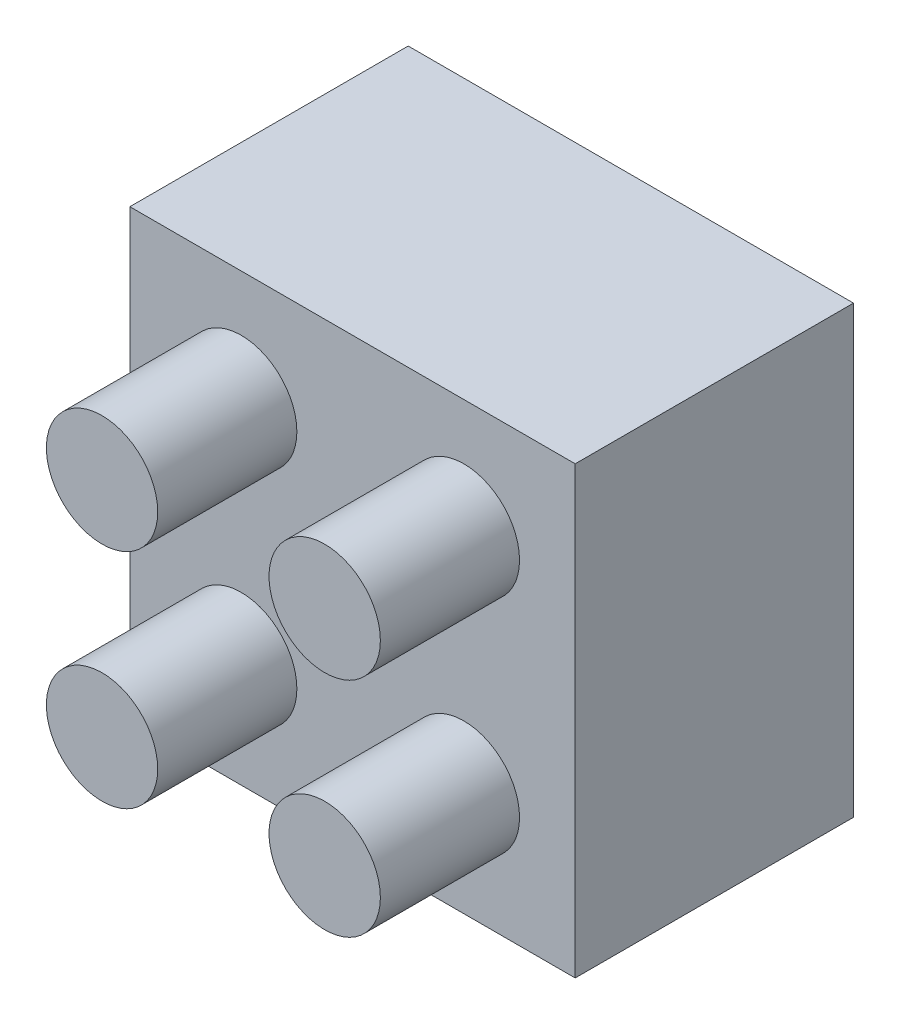
from build123d import *

# Parameters (mm, degrees)
SKETCH1_W           = 16
SKETCH1_H           = 16
BOSS_EXTRUDE1_DEPTH = 10
SKETCH2_R           = 2
BOSS_EXTRUDE3_DEPTH = 5
SKETCH3_W           = 13.5
SKETCH3_H           = 13.650151982
CUT_EXTRUDE1_DEPTH  = 9
SKETCH4_R           = 3.7
SKETCH4_R_2         = 2.7
BOSS_EXTRUDE4_DEPTH = 9


with BuildPart() as part:
    # Sketch1 → Boss-Extrude1 (new body)
    with BuildSketch(Plane.XY):
        Rectangle(SKETCH1_W, SKETCH1_H)
    extrude(amount=BOSS_EXTRUDE1_DEPTH)

    # Sketch2 → Boss-Extrude3 (add)
    with BuildSketch(Plane.XY.offset(10)):
        with Locations((-4, 4)):
            Circle(SKETCH2_R)
        with Locations((4, 4)):
            Circle(SKETCH2_R)
        with Locations((4, -4)):
            Circle(SKETCH2_R)
        with Locations((-4, -4)):
            Circle(SKETCH2_R)
    extrude(amount=BOSS_EXTRUDE3_DEPTH)

    # Sketch3 → Cut-Extrude1 (cut)
    with BuildSketch(Plane(origin=(0, 0, 0), x_dir=(-1, 0, 0), z_dir=(0, 0, -1))):
        Rectangle(SKETCH3_W, SKETCH3_H)
    extrude(amount=-CUT_EXTRUDE1_DEPTH, mode=Mode.SUBTRACT)

    # Sketch4 → Boss-Extrude4 (add)
    with BuildSketch(Plane(origin=(0, 0, 9), x_dir=(-1, 0, 0), z_dir=(0, 0, -1))):
        Circle(SKETCH4_R)
        Circle(SKETCH4_R_2, mode=Mode.SUBTRACT)
    extrude(amount=BOSS_EXTRUDE4_DEPTH)


solid = part.part
